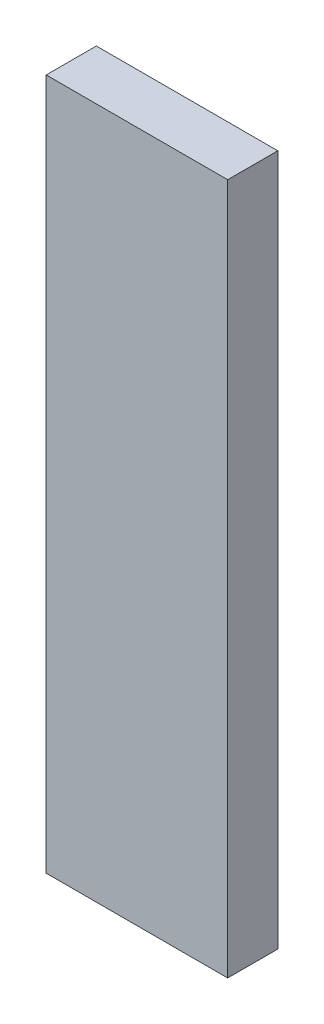
from build123d import *

# Parameters (mm, degrees)
SKETCH1_W           = 10.5
SKETCH1_H           = 2.9
BOSS_EXTRUDE1_DEPTH = 40


with BuildPart() as part:
    # Sketch1 → Boss-Extrude1 (new body)
    with BuildSketch(Plane(origin=(0, 0, 0), x_dir=(1, 0, 0), z_dir=(0, 1, 0))):
        Rectangle(SKETCH1_W, SKETCH1_H)
    extrude(amount=BOSS_EXTRUDE1_DEPTH)


solid = part.part
